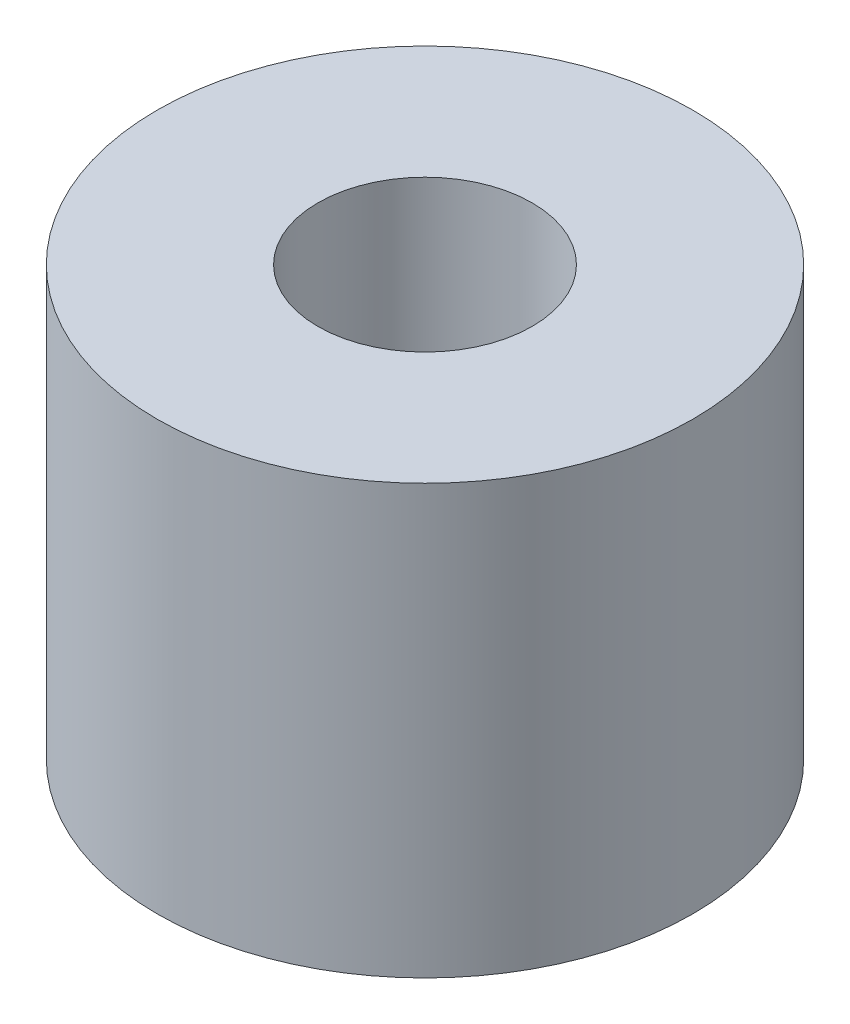
from build123d import *

# Parameters (mm, degrees)
SKETCH1_R           = 2.5
BOSS_EXTRUDE1_DEPTH = 4
SKETCH2_R           = 1
CUT_EXTRUDE1_DEPTH  = 6.338539126


with BuildPart() as part:
    # Sketch1 → Boss-Extrude1 (new body)
    with BuildSketch(Plane(origin=(0, 0, 0), x_dir=(1, 0, 0), z_dir=(0, 1, 0))):
        with Locations(Location((0, 0, 0), (0, 0, 270))):
            Circle(SKETCH1_R)
    extrude(amount=BOSS_EXTRUDE1_DEPTH)

    # Sketch2 → Cut-Extrude1 (cut, through all)
    with BuildSketch(Plane(origin=(0, 4, 0), x_dir=(1, 0, 0), z_dir=(0, 1, 0))):
        with Locations(Location((0, 0, 0), (0, 0, 270))):
            Circle(SKETCH2_R)
    extrude(amount=-CUT_EXTRUDE1_DEPTH, mode=Mode.SUBTRACT)


solid = part.part
